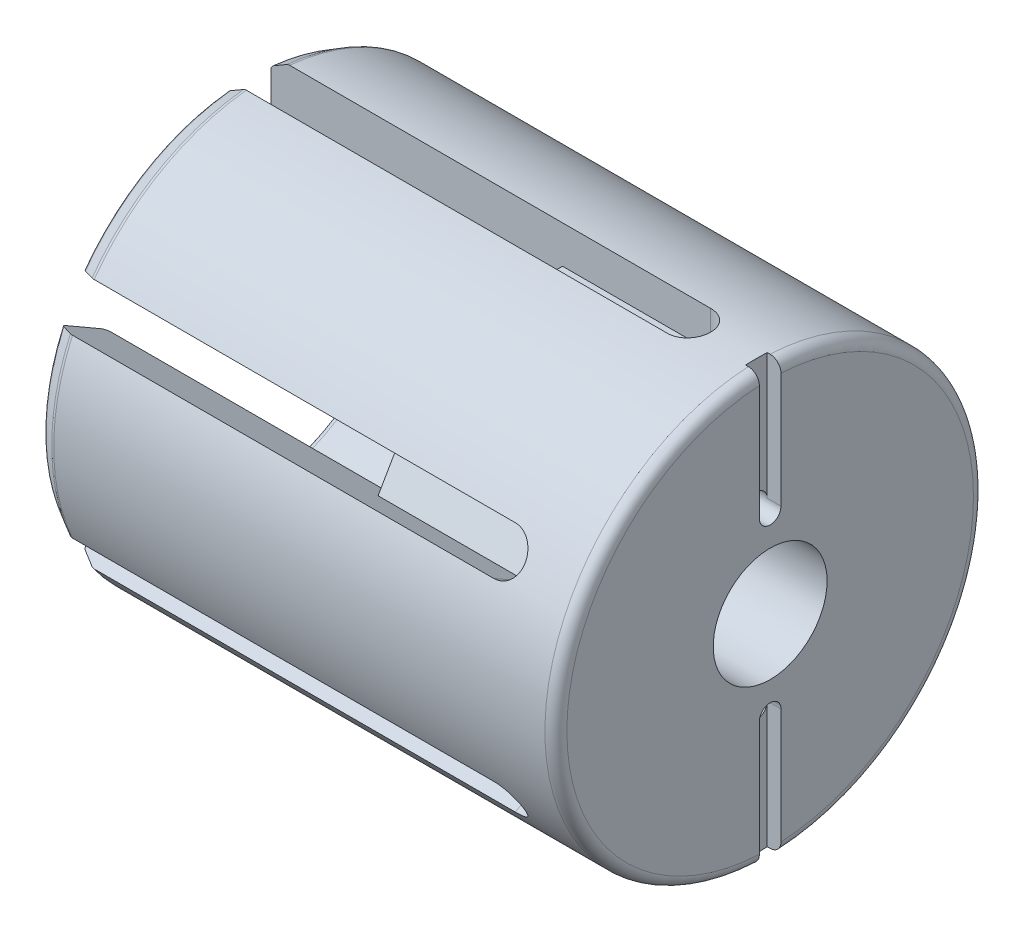
from build123d import *

# Parameters (mm, degrees)
TAPPED_HOLE_FOR_5_16_18_HELICOIL1_D     = 8.4328
TAPPED_HOLE_FOR_5_16_18_HELICOIL1_DEPTH = 28.7782
TAPPED_HOLE_FOR_5_16_18_HELICOIL1_TIP   = 2.533468714
CUT_EXTRUDE1_DEPTH                      = 21.59
CIRPATTERN1_COUNT                       = 6
CUT_EXTRUDE2_DEPTH                      = 7
CIRPATTERN2_COUNT                       = 6
SKETCH6_R                               = 0.8001
CUT_EXTRUDE3_DEPTH                      = 32.134438075
CIRPATTERN3_COUNT                       = 2
CUT_EXTRUDE4_DEPTH                      = 1.016
FILLET1_R                               = 0.8128


with BuildPart() as part:
    # Sketch1 → Revolve1 (revolve)
    with BuildSketch(Plane.XY, mode=Mode.PRIVATE) as revolve1_sk:
        with BuildLine():
            Line((-37.179905394, 15.8623), (0, 15.8623))
            Line((0, 15.8623), (0, 0))
            Line((0, 0), (-16.968799946, 0))
            Line((-16.968799946, 0), (-16.968799946, 11.43))
            Line((-16.968799946, 11.43), (-38.152399946, 11.43))
            ThreePointArc((-38.152399946, 11.43), (-38.439768142, 11.549031804), (-38.558799946, 11.8364))
            Line((-38.558799946, 11.8364), (-38.558799946, 14.894430009))
            ThreePointArc((-38.558799946, 14.894430009), (-38.50435267, 15.097630009), (-38.355599946, 15.246382733))
            Line((-38.355599946, 15.246382733), (-37.383105394, 15.807852724))
            ThreePointArc((-37.383105394, 15.807852724), (-37.285089454, 15.848452256), (-37.179905394, 15.8623))
        make_face()
    revolve(revolve1_sk.sketch.rotate(Axis((0, 0, 0), (1, 0, 0)), 90), axis=Axis((0, 0, 0), (1, 0, 0)))

    # Tapped Hole for 5/16-18 Helicoil1
    with Locations(Plane(origin=(0, 0, 0), x_dir=(0, 0, -1), z_dir=(1, 0, 0))):
        with Locations((0, 0)):
            Hole(TAPPED_HOLE_FOR_5_16_18_HELICOIL1_D / 2, depth=TAPPED_HOLE_FOR_5_16_18_HELICOIL1_DEPTH)
            with Locations((0, 0, -(TAPPED_HOLE_FOR_5_16_18_HELICOIL1_DEPTH + TAPPED_HOLE_FOR_5_16_18_HELICOIL1_TIP / 2))):  # 118° drill point
                Cone(0, TAPPED_HOLE_FOR_5_16_18_HELICOIL1_D / 2, TAPPED_HOLE_FOR_5_16_18_HELICOIL1_TIP, mode=Mode.SUBTRACT)

    # Sketch4 → Cut-Extrude1 (cut)
    with BuildSketch(Plane.ZY.offset(38.558799946)):
        with BuildLine():
            Line((-1.6002, 15.78137894), (-1.6002, 11.317431686))
            ThreePointArc((-1.6002, 11.317431686), (0, 11.43), (1.6002, 11.317431686))
            Line((1.6002, 11.317431686), (1.6002, 15.78137894))
            ThreePointArc((1.6002, 15.78137894), (0, 15.8623), (-1.6002, 15.78137894))
        make_face()
    cut_extrude1 = extrude(amount=-CUT_EXTRUDE1_DEPTH, mode=Mode.SUBTRACT)

    # CirPattern1: Cut-Extrude1 ×6 about axis
    cirpattern1_axis = Axis((0, 0, 0), (1, 0, 0))
    for i in range(1, CIRPATTERN1_COUNT):
        add(cut_extrude1.rotate(cirpattern1_axis, i * 360 / CIRPATTERN1_COUNT), mode=Mode.SUBTRACT)

    # Sketch5 → Cut-Extrude2 (cut)
    with BuildSketch(Plane(origin=(0, 20, 0), x_dir=(1, 0, 0), z_dir=(0, 1, 0))):
        with BuildLine():
            Line((-16.968799946, 1.6002), (-6, 1.6002))
            ThreePointArc((-6, 1.6002), (-4.3998, 0), (-6, -1.6002))
            Line((-6, -1.6002), (-16.968799946, -1.6002))
            Line((-16.968799946, -1.6002), (-16.968799946, 1.6002))
        make_face()
    cut_extrude2 = extrude(amount=-CUT_EXTRUDE2_DEPTH, mode=Mode.SUBTRACT)

    # CirPattern2: Cut-Extrude2 ×6 about axis
    cirpattern2_axis = Axis((0, 0, 0), (1, 0, 0))
    for i in range(1, CIRPATTERN2_COUNT):
        add(cut_extrude2.rotate(cirpattern2_axis, i * 360 / CIRPATTERN2_COUNT), mode=Mode.SUBTRACT)

    # Sketch6 → Cut-Extrude3 (cut, through all)
    with BuildSketch(Plane.ZY.offset(16.968799946)):
        with Locations((0, 6.5)):
            Circle(SKETCH6_R)
    cut_extrude3 = extrude(amount=-CUT_EXTRUDE3_DEPTH, mode=Mode.SUBTRACT)

    # CirPattern3: Cut-Extrude3 ×2 about axis
    cirpattern3_axis = Axis((0, 0, 0), (1, 0, 0))
    for i in range(1, CIRPATTERN3_COUNT):
        add(cut_extrude3.rotate(cirpattern3_axis, i * 360 / CIRPATTERN3_COUNT), mode=Mode.SUBTRACT)

    # Sketch7 → Cut-Extrude4 (cut)
    with BuildSketch(Plane(origin=(0, 0, 0), x_dir=(0, 0, -1), z_dir=(1, 0, 0))):
        with BuildLine():
            Line((-0.8001, 15.842108486), (-0.8001, 6.5))
            ThreePointArc((-0.8001, 6.5), (0, 5.6999), (0.8001, 6.5))
            Line((0.8001, 6.5), (0.8001, 15.842108486))
            ThreePointArc((0.8001, 15.842108486), (0, 15.8623), (-0.8001, 15.842108486))
        make_face()
        with BuildLine():
            Line((0.8001, -15.842108486), (0.8001, -6.5))
            ThreePointArc((0.8001, -6.5), (0, -5.6999), (-0.8001, -6.5))
            Line((-0.8001, -6.5), (-0.8001, -15.842108486))
            ThreePointArc((-0.8001, -15.842108486), (0, -15.8623), (0.8001, -15.842108486))
        make_face()
    extrude(amount=-CUT_EXTRUDE4_DEPTH, mode=Mode.SUBTRACT)

    # Fillet1
    fillet1_edges = [part.edges().sort_by_distance(p)[0] for p in [
        (0, 0, -15.8623),
        (0, -10.929801807, 11.495738069),
    ]]
    fillet(fillet1_edges, radius=FILLET1_R)


solid = part.part
